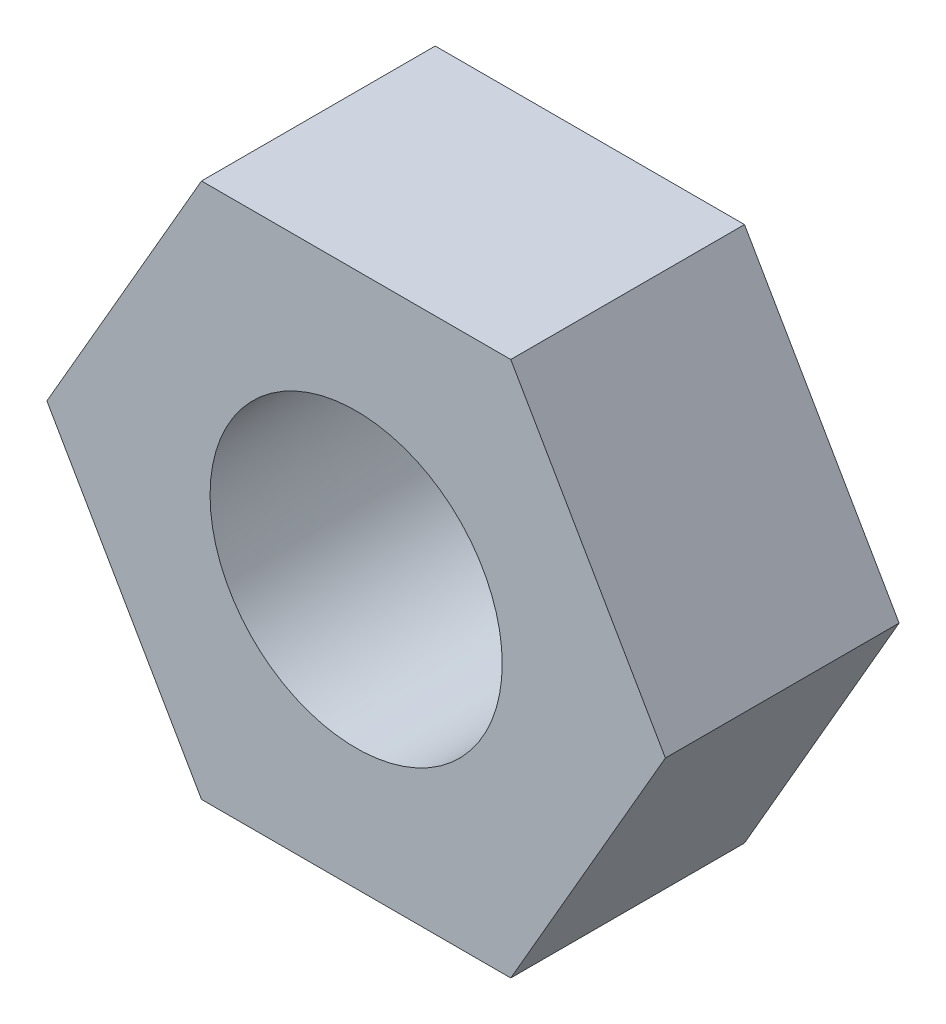
from build123d import *

# Parameters (mm, degrees)
ESQUISSE1_R        = 1.5
BOSS_EXTRU_1_DEPTH = 2.4


with BuildPart() as part:
    # Esquisse1 → Boss.-Extru.1 (new body)
    with BuildSketch(Plane.XY):
        Polygon((3.175426481, 0), (1.58771324, 2.75), (-1.58771324, 2.75), (-3.175426481, 0), (-1.58771324, -2.75), (1.58771324, -2.75), align=None)
        Circle(ESQUISSE1_R, mode=Mode.SUBTRACT)
    extrude(amount=BOSS_EXTRU_1_DEPTH)


solid = part.part
